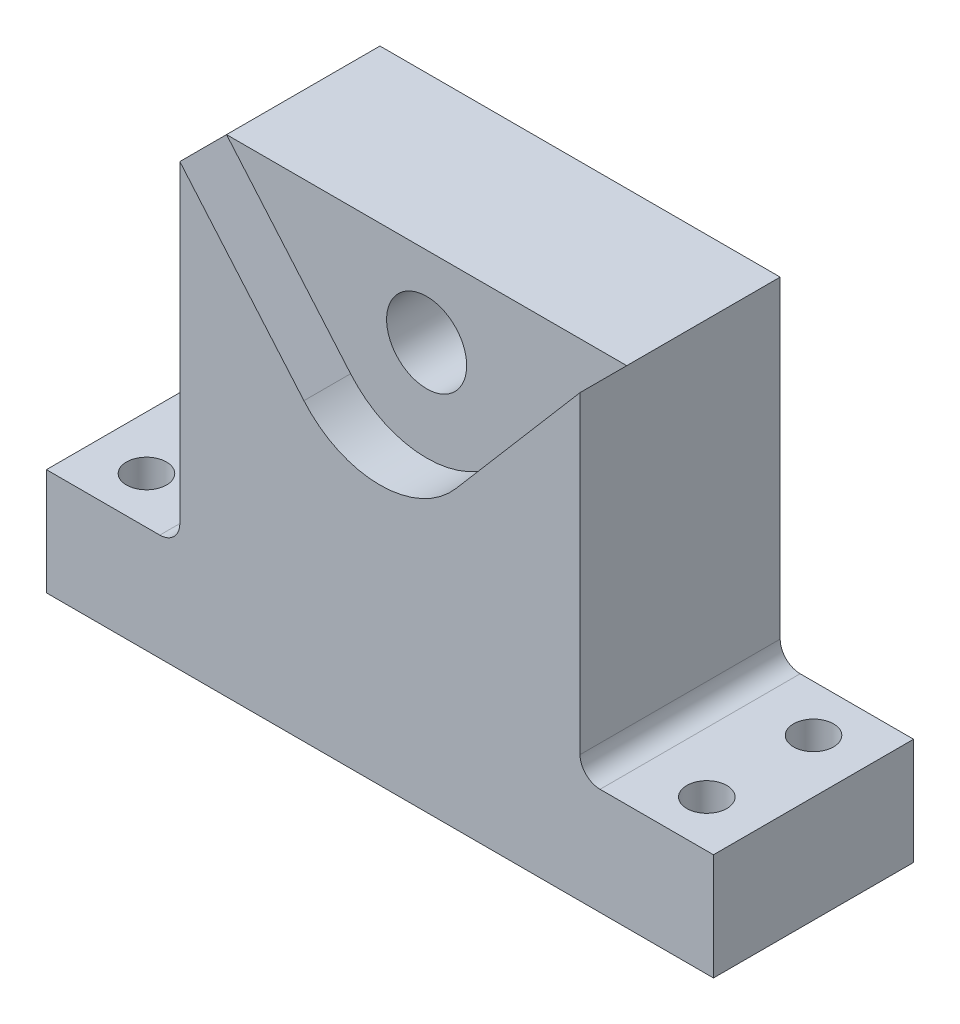
from build123d import *

# Parameters (mm, degrees)
EXTRUDE_1_DEPTH     = 15
SKETCH_2_R          = 3
CUT_EXTRUDE_1_DEPTH = 45.034077713
SKETCH_3_R          = 1.5
CUT_EXTRUDE_2_DEPTH = 39.405728739
FILLET_1_R          = 1.5
CUT_EXTRUDE_3_DEPTH = 3.5


with BuildPart() as part:
    # 草图1 → 凸台-拉伸1 (new body)
    with BuildSketch(Plane.XY):
        Polygon((25, 0), (-25, 0), (-25, 8), (-15, 8), (-15, 33), (15, 33), (15, 8), (25, 8), align=None)
    extrude(amount=EXTRUDE_1_DEPTH)

    # 草图2 → 切除-拉伸1 (cut, through all)
    with BuildSketch(Plane.XY.offset(15)):
        with Locations((0, 27)):
            Circle(SKETCH_2_R)
    extrude(amount=-CUT_EXTRUDE_1_DEPTH, mode=Mode.SUBTRACT)

    # 草图3 → 切除-拉伸2 (cut, through all)
    with BuildSketch(Plane(origin=(0, 8, 0), x_dir=(1, 0, 0), z_dir=(0, 1, 0))):
        with Locations(Location((21, -3.5, 0), (0, 0, 180))):
            Circle(SKETCH_3_R)
        with Locations((21, -11.5)):
            Circle(SKETCH_3_R)
        with Locations(Location((-21, -11.5, 0), (0, 0, 180))):
            Circle(SKETCH_3_R)
        with Locations((-21, -3.5)):
            Circle(SKETCH_3_R)
    extrude(amount=-CUT_EXTRUDE_2_DEPTH, mode=Mode.SUBTRACT)

    # 圆角1
    fillet_1_edges = [part.edges().sort_by_distance(p)[0] for p in [
        (-15, 8, 7.5),
        (15, 8, 7.5),
    ]]
    fillet(fillet_1_edges, radius=FILLET_1_R)

    # 草图4 → 切除-拉伸3 (cut)
    with BuildSketch(Plane.XY.offset(15)):
        with BuildLine():
            Line((-15, 33), (-5.699842762, 22.125393094))
            ThreePointArc((-5.699842762, 22.125393094), (-7.45476136, 27.822516302), (-4.5, 33))
            Line((-4.5, 33), (-15, 33))
        make_face()
        with BuildLine():
            ThreePointArc((-5.699842762, 22.125393094), (-3.137710009, 20.1878949), (0, 19.5))
            Line((0, 19.5), (0, 24))
            ThreePointArc((0, 24), (-3, 27), (0, 30))
            Line((0, 30), (0, 33))
            Line((0, 33), (-4.5, 33))
            ThreePointArc((-4.5, 33), (-7.45476136, 27.822516302), (-5.699842762, 22.125393094))
        make_face()
        with BuildLine():
            Line((0, 24), (0, 19.5))
            ThreePointArc((0, 19.5), (3.137710009, 20.1878949), (5.699842762, 22.125393094))
            ThreePointArc((5.699842762, 22.125393094), (7.035581736, 24.401810315), (7.5, 27))
            ThreePointArc((7.5, 27), (6.708203932, 30.354101966), (4.5, 33))
            Line((4.5, 33), (0, 33))
            Line((0, 33), (0, 30))
            ThreePointArc((0, 30), (2.121320344, 29.121320344), (3, 27))
            ThreePointArc((3, 27), (2.121320344, 24.878679656), (0, 24))
        make_face()
        with BuildLine():
            ThreePointArc((7.5, 27), (7.035581736, 24.401810315), (5.699842762, 22.125393094))
            Line((5.699842762, 22.125393094), (15, 33))
            Line((15, 33), (4.5, 33))
            ThreePointArc((4.5, 33), (6.708203932, 30.354101966), (7.5, 27))
        make_face()
    extrude(amount=-CUT_EXTRUDE_3_DEPTH, mode=Mode.SUBTRACT)


solid = part.part
